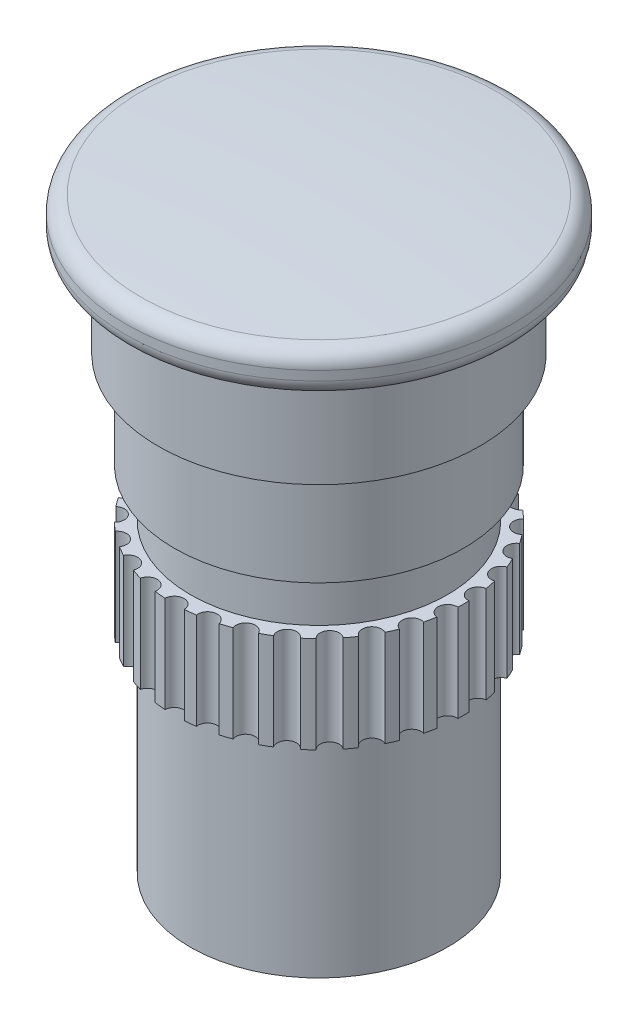
from build123d import *

# Parameters (mm, degrees)
SKETCH_3_R          = 10
EXTRUDE_1_DEPTH     = 6
SKETCH_5_R          = 9
EXTRUDE_2_DEPTH     = 6
SKETCH_7_R          = 8
EXTRUDE_3_DEPTH     = 3
SKETCH_10_R         = 9
EXTRUDE_4_DEPTH     = 6
SKETCH_11_R         = 8
EXTRUDE_5_DEPTH     = 13
FILLET_1_R          = 1
SKETCH_12_R         = 0.6
CUT_EXTRUDE_1_DEPTH = 6


with BuildPart() as part:
    # 草图1 → 旋转1 (revolve)
    with BuildSketch(Plane.XY, mode=Mode.PRIVATE) as revolve_1_sk:
        with BuildLine():
            Line((12, 0), (12, 2.5))
            ThreePointArc((12, 2.5), (6.005206075, 2.874945794), (0, 3))
            Line((0, 3), (0, 0))
            Line((0, 0), (12, 0))
        make_face()
    revolve(revolve_1_sk.sketch.rotate(Axis((0, 3, 0), (0, -1, 0)), 180), axis=Axis((0, 3, 0), (0, -1, 0)))

    # 草图3 → 凸台-拉伸1 (add)
    with BuildSketch(Plane.XZ):
        with Locations(Location((0, 0, 0), (0, 0, 270))):
            Circle(SKETCH_3_R)
    extrude(amount=EXTRUDE_1_DEPTH)

    # 草图5 → 凸台-拉伸2 (add)
    with BuildSketch(Plane.XZ.offset(6)):
        with Locations(Location((0, 0, 0), (0, 0, 270))):
            Circle(SKETCH_5_R)
    extrude(amount=EXTRUDE_2_DEPTH)

    # 草图7 → 凸台-拉伸3 (add)
    with BuildSketch(Plane.XZ.offset(12)):
        with Locations(Location((0, 0, 0), (0, 0, 270))):
            Circle(SKETCH_7_R)
    extrude(amount=EXTRUDE_3_DEPTH)

    # 草图10 → 凸台-拉伸4 (add)
    with BuildSketch(Plane.XZ.offset(15)):
        with Locations(Location((0, 0, 0), (0, 0, 270))):
            Circle(SKETCH_10_R)
    extrude(amount=EXTRUDE_4_DEPTH)

    # 草图11 → 凸台-拉伸5 (add)
    with BuildSketch(Plane.XZ.offset(21)):
        with Locations(Location((0, 0, 0), (0, 0, 270))):
            Circle(SKETCH_11_R)
    extrude(amount=EXTRUDE_5_DEPTH)

    # 圆角1
    fillet_1_edges = [part.edges().sort_by_distance(p)[0] for p in [
        (12, 0, 0),
        (12, 2.5, 0),
    ]]
    fillet(fillet_1_edges, radius=FILLET_1_R)

    # 草图12 → 切除-拉伸1 (cut)
    with BuildSketch(Plane.XZ.offset(21)):
        with Locations((0, 9)):
            Circle(SKETCH_12_R)
        with Locations((1.871205217, 8.803328407)):
            Circle(SKETCH_12_R)
        with Locations((3.660629788, 8.221909119)):
            Circle(SKETCH_12_R)
        with Locations((5.290067271, 7.281152949)):
            Circle(SKETCH_12_R)
        with Locations((6.688303429, 6.022175457)):
            Circle(SKETCH_12_R)
        with Locations((7.794228634, 4.5)):
            Circle(SKETCH_12_R)
        with Locations((8.559508647, 2.781152949)):
            Circle(SKETCH_12_R)
        with Locations((8.950697058, 0.940756169)):
            Circle(SKETCH_12_R)
        with Locations((8.950697058, -0.940756169)):
            Circle(SKETCH_12_R)
        with Locations((8.559508647, -2.781152949)):
            Circle(SKETCH_12_R)
        with Locations((7.794228634, -4.5)):
            Circle(SKETCH_12_R)
        with Locations((6.688303429, -6.022175457)):
            Circle(SKETCH_12_R)
        with Locations((5.290067271, -7.281152949)):
            Circle(SKETCH_12_R)
        with Locations((3.660629788, -8.221909119)):
            Circle(SKETCH_12_R)
        with Locations((1.871205217, -8.803328407)):
            Circle(SKETCH_12_R)
        with Locations((0, -9)):
            Circle(SKETCH_12_R)
        with Locations((-1.871205217, -8.803328407)):
            Circle(SKETCH_12_R)
        with Locations((-3.660629788, -8.221909119)):
            Circle(SKETCH_12_R)
        with Locations((-5.290067271, -7.281152949)):
            Circle(SKETCH_12_R)
        with Locations((-6.688303429, -6.022175457)):
            Circle(SKETCH_12_R)
        with Locations((-7.794228634, -4.5)):
            Circle(SKETCH_12_R)
        with Locations((-8.559508647, -2.781152949)):
            Circle(SKETCH_12_R)
        with Locations((-8.950697058, -0.940756169)):
            Circle(SKETCH_12_R)
        with Locations((-8.950697058, 0.940756169)):
            Circle(SKETCH_12_R)
        with Locations((-8.559508647, 2.781152949)):
            Circle(SKETCH_12_R)
        with Locations((-7.794228634, 4.5)):
            Circle(SKETCH_12_R)
        with Locations((-6.688303429, 6.022175457)):
            Circle(SKETCH_12_R)
        with Locations((-5.290067271, 7.281152949)):
            Circle(SKETCH_12_R)
        with Locations((-3.660629788, 8.221909119)):
            Circle(SKETCH_12_R)
        with Locations((-1.871205217, 8.803328407)):
            Circle(SKETCH_12_R)
    extrude(amount=-CUT_EXTRUDE_1_DEPTH, mode=Mode.SUBTRACT)


solid = part.part
